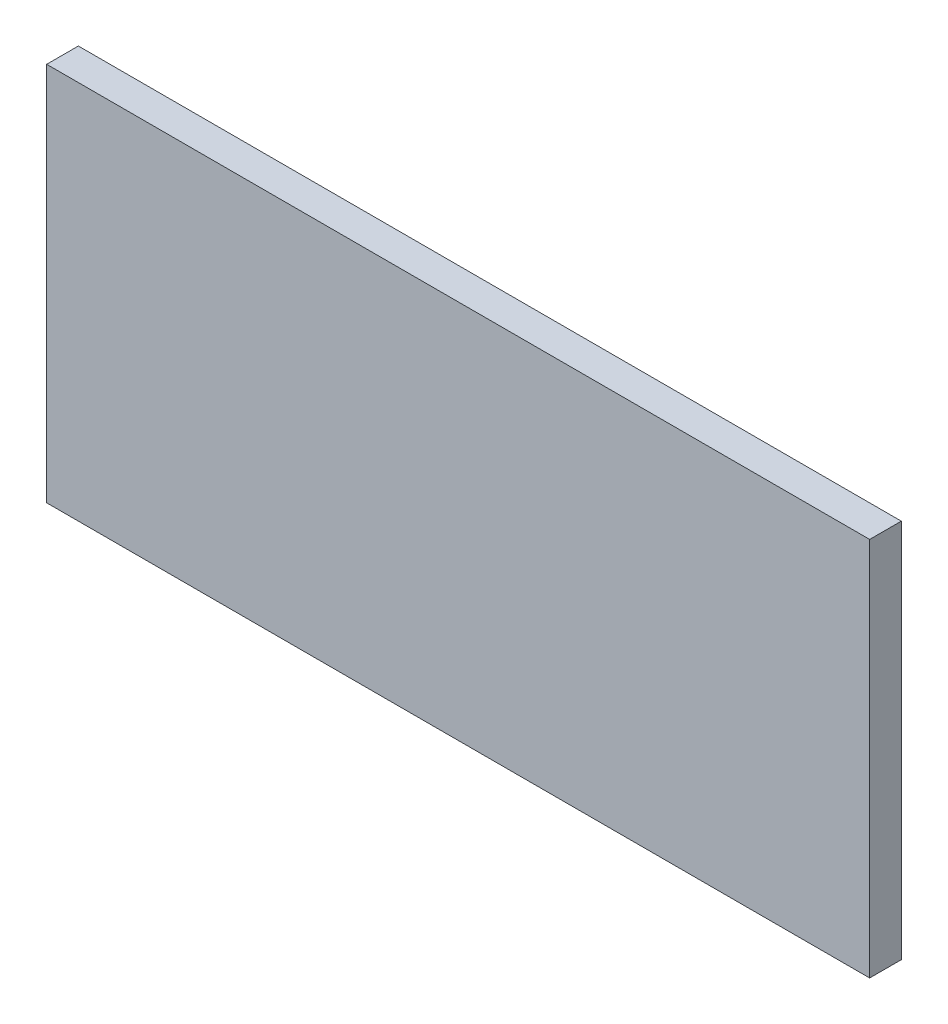
from build123d import *

# Parameters (mm, degrees)
SKETCH1_W           = 82.55
SKETCH1_H           = 38.1
BOSS_EXTRUDE1_DEPTH = 3.175


with BuildPart() as part:
    # Sketch1 → Boss-Extrude1 (new body)
    with BuildSketch(Plane.XY):
        Rectangle(SKETCH1_W, SKETCH1_H)
    extrude(amount=BOSS_EXTRUDE1_DEPTH)


solid = part.part
